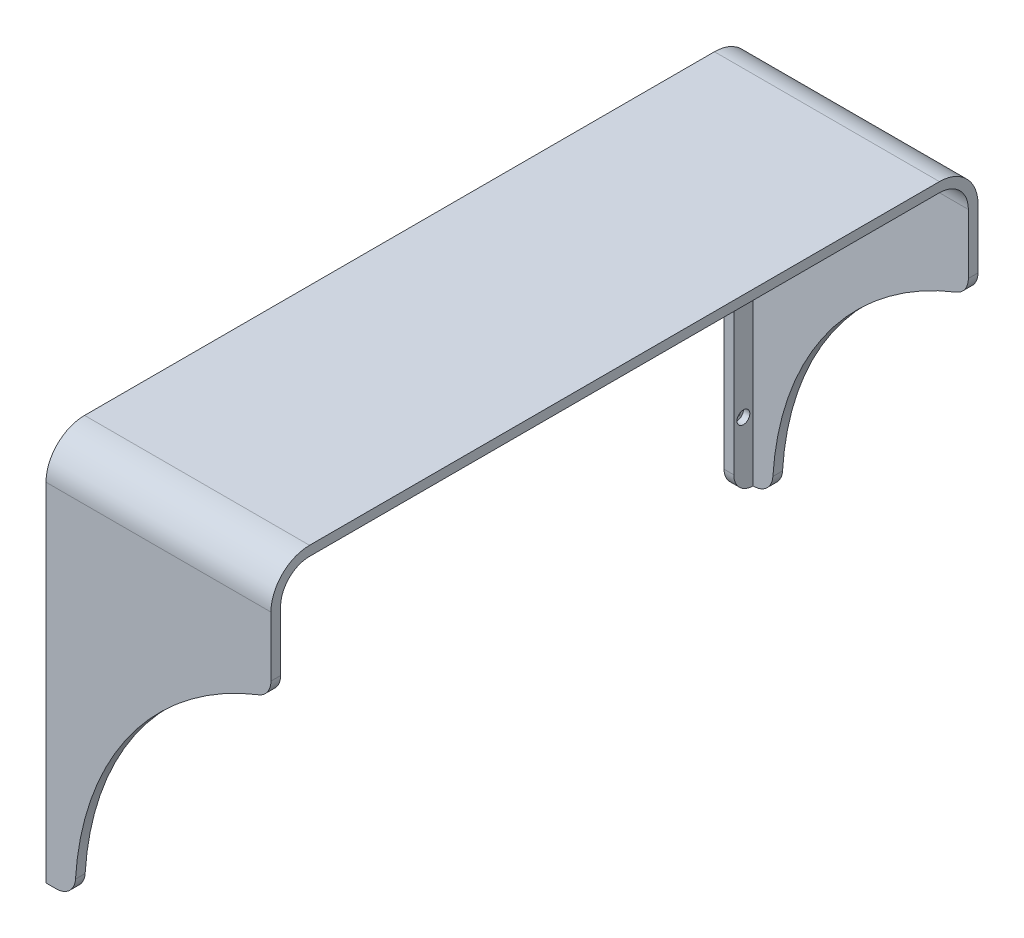
from build123d import *

# Parameters (mm, degrees)
BOSS_EXTRUDE1_DEPTH = 70
BOSS_EXTRUDE2_DEPTH = 3
SKETCH2_R           = 90
CUT_EXTRUDE1_DEPTH  = 239.537208838
FILLET2_R           = 9
FILLET3_R           = 3
FILLET4_R           = 12
FILLET5_R           = 6
SKETCH3_R           = 2
CUT_EXTRUDE2_DEPTH  = 2
SKETCH4_R           = 1.1
CUT_EXTRUDE3_DEPTH  = 3


with BuildPart() as part:
    # Sketch1 → Boss-Extrude1 (new body)
    with BuildSketch(Plane(origin=(0, 0, 0), x_dir=(0, 0, -1), z_dir=(1, 0, 0))):
        Polygon((-107, -60), (-107, 57), (107, 57), (107, -60), (110, -60), (110, 60), (-110, 60), (-110, -60), align=None)
    extrude(amount=BOSS_EXTRUDE1_DEPTH)

    # Sketch1<3> → Boss-Extrude2 (add)
    with BuildSketch(Plane(origin=(0, 0, 0), x_dir=(0, 0, -1), z_dir=(1, 0, 0))):
        Polygon((107, 57), (-107, 57), (-107, -60), (-101, -60), (-101, 51), (101, 51), (101, -60), (107, -60), align=None)
    extrude(amount=BOSS_EXTRUDE2_DEPTH)

    # Sketch2 → Cut-Extrude1 (cut, through all)
    with BuildSketch(Plane.XY.offset(110)):
        with Locations((99, -60)):
            Circle(SKETCH2_R)
    extrude(amount=-CUT_EXTRUDE1_DEPTH, mode=Mode.SUBTRACT)

    # Fillet2
    fillet2_edges = [part.edges().sort_by_distance(p)[0] for p in [
        (36.5, 57, -107),
        (36.5, 57, 107),
    ]]
    fillet(fillet2_edges, radius=FILLET2_R)

    # Fillet3
    fillet3_edges = [part.edges().sort_by_distance(p)[0] for p in [
        (1.5, 51, -101),
        (1.5, 51, 101),
    ]]
    fillet(fillet3_edges, radius=FILLET3_R)

    # Fillet4
    fillet4_edges = [part.edges().sort_by_distance(p)[0] for p in [
        (35, 60, -110),
        (35, 60, 110),
    ]]
    fillet(fillet4_edges, radius=FILLET4_R)

    # Fillet5
    fillet5_edges = [part.edges().sort_by_distance(p)[0] for p in [
        (1.5, -60, 101),
        (9, -60, 108.5),
        (1.5, -60, -101),
        (9, -60, -108.5),
        (70, 25.199765258, -108.5),
        (70, 25.199765258, 108.5),
    ]]
    fillet(fillet5_edges, radius=FILLET5_R)

    # Sketch3 → Cut-Extrude2 (cut)
    with BuildSketch(Plane(origin=(3, 0, 0), x_dir=(0, 0, -1), z_dir=(1, 0, 0))):
        with Locations((-104, -40)):
            Circle(SKETCH3_R)
        with Locations((-104, 20)):
            Circle(SKETCH3_R)
        with Locations((-70, 54)):
            Circle(SKETCH3_R)
        with Locations((0, 54)):
            Circle(SKETCH3_R)
        with Locations((70, 54)):
            Circle(SKETCH3_R)
        with Locations((104, 20)):
            Circle(SKETCH3_R)
        with Locations((104, -40)):
            Circle(SKETCH3_R)
    extrude(amount=-CUT_EXTRUDE2_DEPTH, mode=Mode.SUBTRACT)

    # Sketch4 → Cut-Extrude3 (cut)
    with BuildSketch(Plane(origin=(3, 0, 0), x_dir=(0, 0, -1), z_dir=(1, 0, 0))):
        with Locations((-104, -40)):
            Circle(SKETCH4_R)
        with Locations((-104, 20)):
            Circle(SKETCH4_R)
        with Locations((-70, 54)):
            Circle(SKETCH4_R)
        with Locations((0, 54)):
            Circle(SKETCH4_R)
        with Locations((70, 54)):
            Circle(SKETCH4_R)
        with Locations((104, 20)):
            Circle(SKETCH4_R)
        with Locations((104, -40)):
            Circle(SKETCH4_R)
    extrude(amount=-CUT_EXTRUDE3_DEPTH, mode=Mode.SUBTRACT)


solid = part.part
